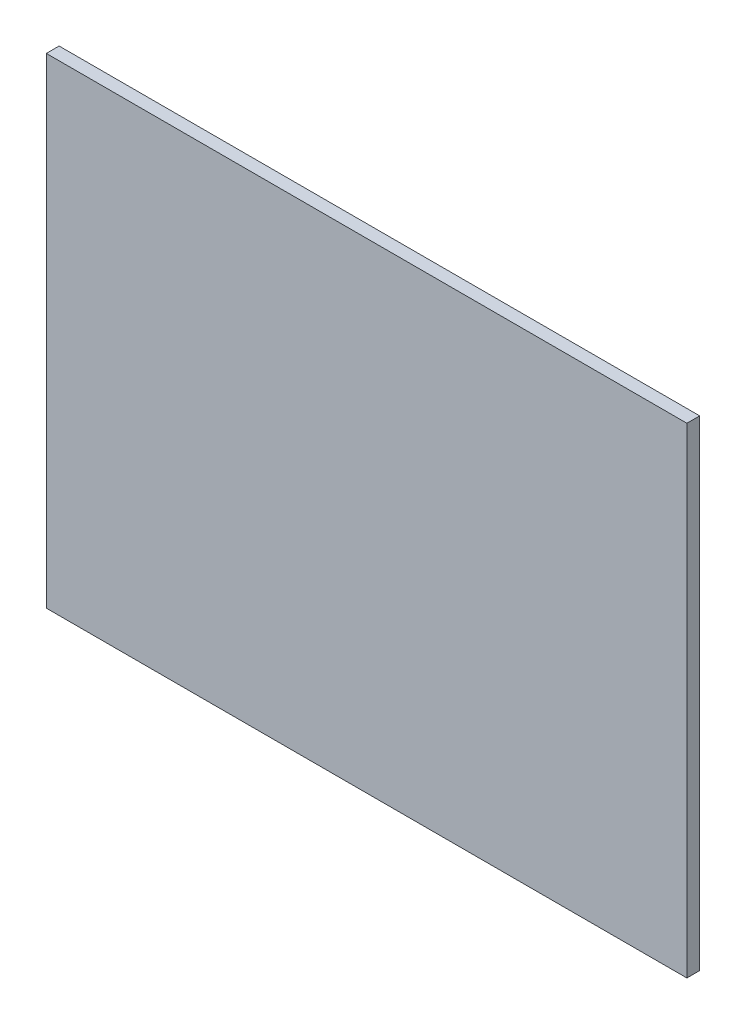
from build123d import *

# Parameters (mm, degrees)
SKETCH1_W           = 200
SKETCH1_H           = 150
BOSS_EXTRUDE1_DEPTH = 4


with BuildPart() as part:
    # Sketch1 → Boss-Extrude1 (new body)
    with BuildSketch(Plane.XY):
        Rectangle(SKETCH1_W, SKETCH1_H)
    extrude(amount=BOSS_EXTRUDE1_DEPTH)


solid = part.part
